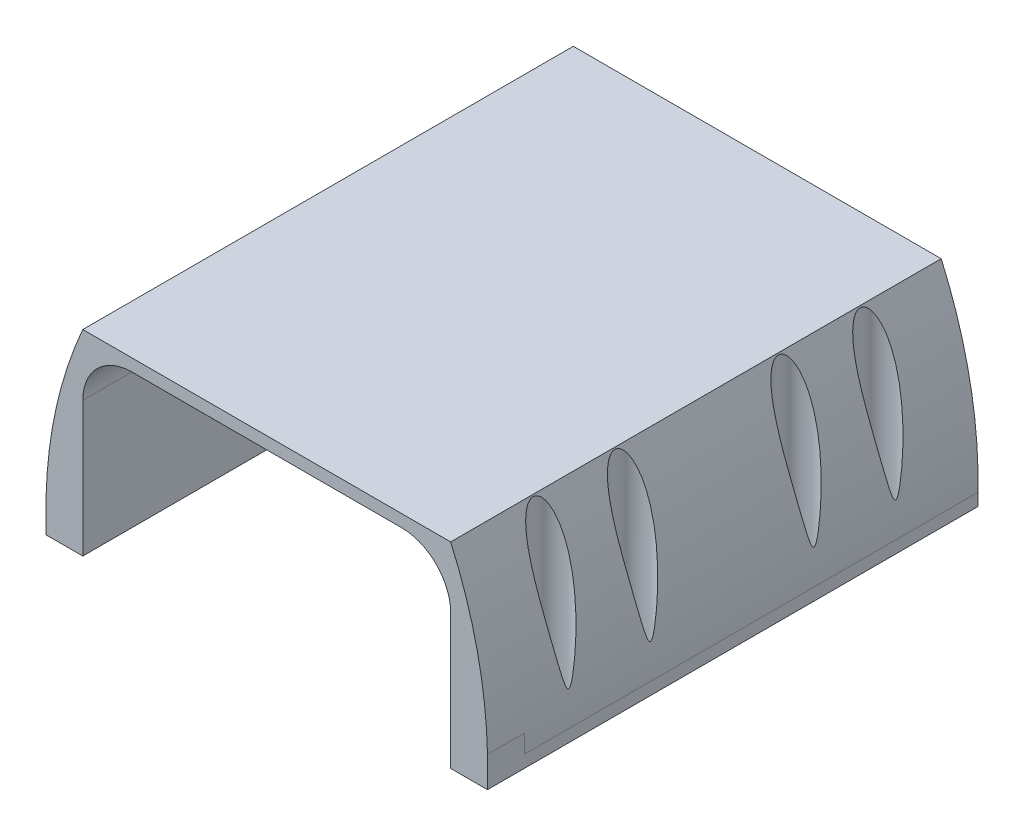
from build123d import *

# Parameters (mm, degrees)
SKETCH1_W            = 150
SKETCH1_H            = 170
BOSS_EXTRUDE11_DEPTH = 80
SKETCH1_17_R         = 7.5
SKETCH1_17_R_2       = 3.25
BOSS_EXTRUDE13_DEPTH = 5
BOSS_EXTRUDE19_DEPTH = 185
SKETCH53_R           = 7.25
CUT_EXTRUDE5_DEPTH   = 184
SKETCH53_5_R         = 7.25
CUT_EXTRUDE6_DEPTH   = 184
SKETCH62_W           = 150
SKETCH62_H           = 15
BOSS_EXTRUDE20_DEPTH = 75
BOSS_EXTRUDE21_START = 15
BOSS_EXTRUDE21_DEPTH = 15
CUT_EXTRUDE10_DEPTH  = 185


with BuildPart() as part:
    # Sketch1 → Boss-Extrude11 (new body)
    with BuildSketch(Plane(origin=(0, 0, 0), x_dir=(1, 0, 0), z_dir=(0, 1, 0))):
        Rectangle(SKETCH1_W, SKETCH1_H)
    extrude(amount=BOSS_EXTRUDE11_DEPTH)

    # Sketch1<17> → Boss-Extrude13 (add)
    # profile 1 of 16: a face of its own
    with BuildSketch(Plane(origin=(0, 0, 0), x_dir=(1, 0, 0), z_dir=(0, 1, 0))):
        with BuildLine():
            Line((-75, -85), (-75, -66.666666667))
            ThreePointArc((-75, -66.666666667), (-82.5, -74.166666667), (-90, -66.666666667))
            Line((-90, -66.666666667), (-90, -100))
            Line((-90, -100), (90, -100))
            Line((90, -100), (90, -66.666666667))
            ThreePointArc((90, -66.666666667), (82.500000079, -74.166666667), (75, -66.666666825))
            Line((75, -66.666666825), (75, -85))
            Line((75, -85), (-75, -85))
        make_face()
    # profile 2 of 16: a face of its own
    with BuildSketch(Plane(origin=(0, 0, 0), x_dir=(1, 0, 0), z_dir=(0, 1, 0))):
        with BuildLine():
            ThreePointArc((90, -33.333333333), (82.500000012, -40.833333333), (75, -33.333333356))
            Line((75, -33.333333356), (75, -66.666666825))
            ThreePointArc((75, -66.666666825), (82.499999921, -59.166666667), (90, -66.666666667))
            Line((90, -66.666666667), (90, -33.333333333))
        make_face()
    # profile 3 of 16: a face of its own
    with BuildSketch(Plane(origin=(0, 0, 0), x_dir=(1, 0, 0), z_dir=(0, 1, 0))):
        with BuildLine():
            ThreePointArc((90, 33.333333333), (82.5, 25.833333333), (75, 33.333333333))
            Line((75, 33.333333333), (75, -33.333333356))
            ThreePointArc((75, -33.333333356), (82.499999988, -25.833333333), (90, -33.333333333))
            Line((90, -33.333333333), (90, 33.333333333))
        make_face()
    # profile 4 of 16: a face of its own
    with BuildSketch(Plane(origin=(0, 0, 0), x_dir=(1, 0, 0), z_dir=(0, 1, 0))):
        with BuildLine():
            ThreePointArc((90, 66.666666667), (82.5, 59.166666667), (75, 66.666666667))
            Line((75, 66.666666667), (75, 33.333333333))
            ThreePointArc((75, 33.333333333), (82.5, 40.833333333), (90, 33.333333333))
            Line((90, 33.333333333), (90, 66.666666667))
        make_face()
    # profile 5 of 16: a face of its own
    with BuildSketch(Plane(origin=(0, 0, 0), x_dir=(1, 0, 0), z_dir=(0, 1, 0))):
        with BuildLine():
            Line((-75, 66.666666667), (-75, 85))
            Line((-75, 85), (75, 85))
            Line((75, 85), (75, 66.666666667))
            ThreePointArc((75, 66.666666667), (82.5, 74.166666667), (90, 66.666666667))
            Line((90, 66.666666667), (90, 100))
            Line((90, 100), (-90, 100))
            Line((-90, 100), (-90, 66.666666704))
            ThreePointArc((-90, 66.666666704), (-82.499999981, 74.166666667), (-75, 66.666666667))
        make_face()
    # profile 6 of 16: a face of its own
    with BuildSketch(Plane(origin=(0, 0, 0), x_dir=(1, 0, 0), z_dir=(0, 1, 0))):
        with BuildLine():
            Line((-75, -66.666666667), (-75, -33.333333333))
            ThreePointArc((-75, -33.333333333), (-82.5, -40.833333333), (-90, -33.333333333))
            Line((-90, -33.333333333), (-90, -66.666666667))
            ThreePointArc((-90, -66.666666667), (-82.5, -59.166666667), (-75, -66.666666667))
        make_face()
    # profile 7 of 16: a face of its own
    with BuildSketch(Plane(origin=(0, 0, 0), x_dir=(1, 0, 0), z_dir=(0, 1, 0))):
        with BuildLine():
            Line((-75, -33.333333333), (-75, 33.333333333))
            ThreePointArc((-75, 33.333333333), (-82.5, 25.833333333), (-90, 33.333333333))
            Line((-90, 33.333333333), (-90, -33.333333333))
            ThreePointArc((-90, -33.333333333), (-82.5, -25.833333333), (-75, -33.333333333))
        make_face()
    # profile 8 of 16: a face of its own
    with BuildSketch(Plane(origin=(0, 0, 0), x_dir=(1, 0, 0), z_dir=(0, 1, 0))):
        with BuildLine():
            Line((-75, 33.333333333), (-75, 66.666666667))
            ThreePointArc((-75, 66.666666667), (-82.500000019, 59.166666667), (-90, 66.666666704))
            Line((-90, 66.666666704), (-90, 33.333333333))
            ThreePointArc((-90, 33.333333333), (-82.5, 40.833333333), (-75, 33.333333333))
        make_face()
    # profile 9 of 16: a face of its own
    with BuildSketch(Plane(origin=(0, 0, 0), x_dir=(1, 0, 0), z_dir=(0, 1, 0))):
        with Locations((-82.5, -66.666666667)):
            Circle(SKETCH1_17_R)
        with Locations(Location((-82.5, -66.666666667, 0), (0, 0, 270))):
            Circle(SKETCH1_17_R_2, mode=Mode.SUBTRACT)
    # profile 10 of 16: a face of its own
    with BuildSketch(Plane(origin=(0, 0, 0), x_dir=(1, 0, 0), z_dir=(0, 1, 0))):
        with Locations((-82.5, -33.333333333)):
            Circle(SKETCH1_17_R)
        with Locations(Location((-82.5, -33.333333333, 0), (0, 0, 270))):
            Circle(SKETCH1_17_R_2, mode=Mode.SUBTRACT)
    # profile 11 of 16: a face of its own
    with BuildSketch(Plane(origin=(0, 0, 0), x_dir=(1, 0, 0), z_dir=(0, 1, 0))):
        with Locations((-82.5, 33.333333333)):
            Circle(SKETCH1_17_R)
        with Locations(Location((-82.5, 33.333333333, 0), (0, 0, 270))):
            Circle(SKETCH1_17_R_2, mode=Mode.SUBTRACT)
    # profile 12 of 16: a face of its own
    with BuildSketch(Plane(origin=(0, 0, 0), x_dir=(1, 0, 0), z_dir=(0, 1, 0))):
        with Locations((-82.5, 66.666666667)):
            Circle(SKETCH1_17_R)
        with Locations(Location((-82.5, 66.666666667, 0), (0, 0, 270))):
            Circle(SKETCH1_17_R_2, mode=Mode.SUBTRACT)
    # profile 13 of 16: a face of its own
    with BuildSketch(Plane(origin=(0, 0, 0), x_dir=(1, 0, 0), z_dir=(0, 1, 0))):
        with Locations((82.5, -66.666666667)):
            Circle(SKETCH1_17_R)
        with Locations(Location((82.5, -66.666666667, 0), (0, 0, 270))):
            Circle(SKETCH1_17_R_2, mode=Mode.SUBTRACT)
    # profile 14 of 16: a face of its own
    with BuildSketch(Plane(origin=(0, 0, 0), x_dir=(1, 0, 0), z_dir=(0, 1, 0))):
        with Locations((82.5, -33.333333333)):
            Circle(SKETCH1_17_R)
        with Locations(Location((82.5, -33.333333333, 0), (0, 0, 270))):
            Circle(SKETCH1_17_R_2, mode=Mode.SUBTRACT)
    # profile 15 of 16: a face of its own
    with BuildSketch(Plane(origin=(0, 0, 0), x_dir=(1, 0, 0), z_dir=(0, 1, 0))):
        with Locations((82.5, 33.333333333)):
            Circle(SKETCH1_17_R)
        with Locations(Location((82.5, 33.333333333, 0), (0, 0, 270))):
            Circle(SKETCH1_17_R_2, mode=Mode.SUBTRACT)
    # profile 16 of 16: a face of its own
    with BuildSketch(Plane(origin=(0, 0, 0), x_dir=(1, 0, 0), z_dir=(0, 1, 0))):
        with Locations((82.5, 66.666666667)):
            Circle(SKETCH1_17_R)
        with Locations(Location((82.5, 66.666666667, 0), (0, 0, 270))):
            Circle(SKETCH1_17_R_2, mode=Mode.SUBTRACT)
    extrude(amount=BOSS_EXTRUDE13_DEPTH)

    # Sketch37 → Boss-Extrude19 (add)
    with BuildSketch(Plane.XY.offset(85)):
        with BuildLine():
            Line((75, 80), (75, 5))
            Line((75, 5), (90, 5))
            ThreePointArc((90, 5), (86.615987505, 43.323197501), (75, 80))
        make_face()
    boss_extrude19 = extrude(amount=-BOSS_EXTRUDE19_DEPTH)

    # Mirror3: Boss-Extrude19 across plane
    add(boss_extrude19.mirror(Plane(origin=(0, 0, 0), x_dir=(0, 0, 1), z_dir=(1, 0, 0))))

    # Sketch53 → Cut-Extrude5 (cut)
    with BuildSketch(Plane(origin=(0, 5, 0), x_dir=(1, 0, 0), z_dir=(0, 1, 0))):
        with Locations(Location((-82.5, -66.666666667, 0), (0, 0, 90))):
            Circle(SKETCH53_R)
    extrude(amount=CUT_EXTRUDE5_DEPTH, mode=Mode.SUBTRACT)

    # Sketch53<5> → Cut-Extrude6 (cut)
    with BuildSketch(Plane(origin=(0, 5, 0), x_dir=(1, 0, 0), z_dir=(0, 1, 0))):
        with Locations(Location((-82.5, -66.666666667, 0), (0, 0, 90))):
            Circle(SKETCH53_5_R)
        with Locations(Location((-82.5, -33.333333333, 0), (0, 0, 90))):
            Circle(SKETCH53_5_R)
        with Locations(Location((82.5, -66.666666667, 0), (0, 0, 90))):
            Circle(SKETCH53_5_R)
        with Locations(Location((82.5, -33.333333333, 0), (0, 0, 90))):
            Circle(SKETCH53_5_R)
        with Locations(Location((-82.5, 33.333333333, 0), (0, 0, 90))):
            Circle(SKETCH53_5_R)
        with Locations(Location((-82.5, 66.666666667, 0), (0, 0, 90))):
            Circle(SKETCH53_5_R)
        with Locations(Location((82.5, 66.666666667, 0), (0, 0, 90))):
            Circle(SKETCH53_5_R)
        with Locations(Location((82.5, 33.333333333, 0), (0, 0, 90))):
            Circle(SKETCH53_5_R)
    extrude(amount=CUT_EXTRUDE6_DEPTH, mode=Mode.SUBTRACT)

    # Sketch62 → Boss-Extrude20 (add)
    with BuildSketch(Plane(origin=(0, 5, 0), x_dir=(1, 0, 0), z_dir=(0, 1, 0))):
        with Locations((0, 92.5)):
            Rectangle(SKETCH62_W, SKETCH62_H)
    extrude(amount=BOSS_EXTRUDE20_DEPTH)

    # Sketch67 → Boss-Extrude21 (add)
    with BuildSketch(Plane.XY.offset(85).offset(BOSS_EXTRUDE21_START)):
        with BuildLine():
            Line((-75, 80), (75, 80))
            ThreePointArc((75, 80), (85.842300391, 46.988689487), (90, 12.492086269))
            Line((90, 12.492086269), (90, 0))
            Line((90, 0), (-90, 0))
            Line((-90, 0), (-90, 5))
            ThreePointArc((-90, 5), (-86.615987505, 43.323197501), (-75, 80))
        make_face()
    extrude(amount=-BOSS_EXTRUDE21_DEPTH)

    # Sketch68 → Cut-Extrude10 (cut)
    with BuildSketch(Plane.XY.offset(100)):
        with BuildLine():
            Line((-75, 0), (75, 0))
            Line((75, 0), (75, 55))
            ThreePointArc((75, 55), (69.142135624, 69.142135624), (55, 75))
            Line((55, 75), (-55, 75))
            ThreePointArc((-55, 75), (-69.142135624, 69.142135624), (-75, 55))
            Line((-75, 55), (-75, 0))
        make_face()
    extrude(amount=-CUT_EXTRUDE10_DEPTH, mode=Mode.SUBTRACT)


solid = part.part
